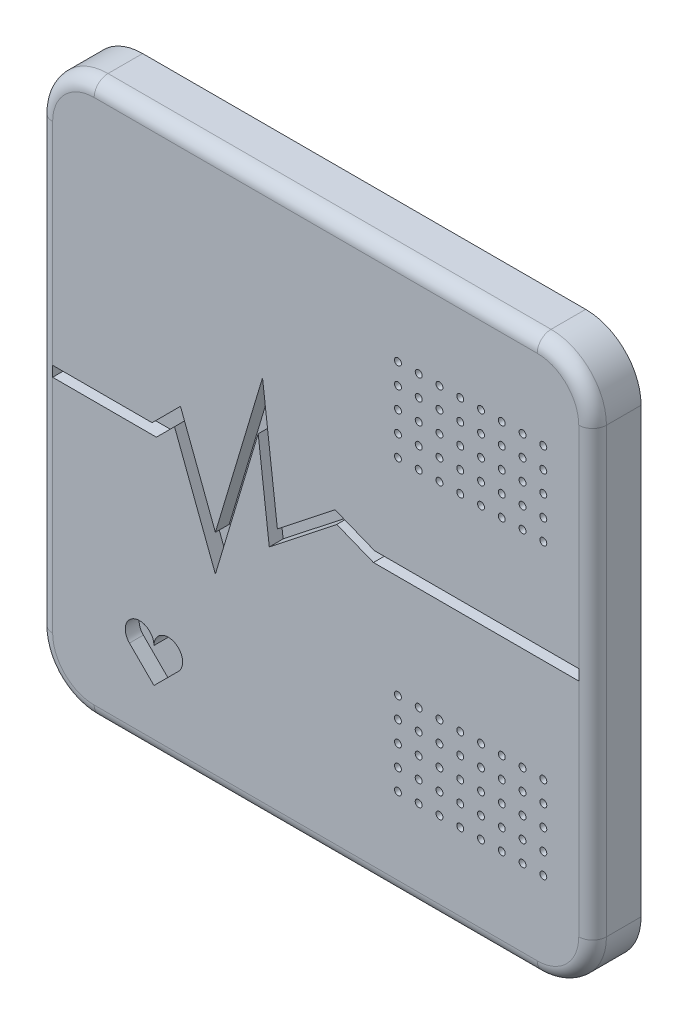
from build123d import *

# Parameters (mm, degrees)
ESQUISSE1_W             = 80
ESQUISSE1_H             = 80
BOSS_EXTRU_1_DEPTH      = 7
CONG_1_R                = 8
CONG_2_R                = 2
ESQUISSE2_W             = 75
ESQUISSE2_H             = 75
ENL_V_MAT_EXTRU_1_DEPTH = 4
ENL_V_MAT_EXTRU_2_DEPTH = 2
ENL_V_MAT_EXTRU_3_DEPTH = 2
ESQUISSE6_R             = 0.5
ENL_V_MAT_EXTRU_4_DEPTH = 58
CONG_3_R                = 3


with BuildPart() as part:
    # Esquisse1 → Boss.-Extru.1 (new body)
    with BuildSketch(Plane.XY):
        Rectangle(ESQUISSE1_W, ESQUISSE1_H)
    extrude(amount=BOSS_EXTRU_1_DEPTH)

    # Congé1
    cong_1_edges = [part.edges().sort_by_distance(p)[0] for p in [
        (40, -40, 3.5),
        (-40, -40, 3.5),
        (-40, 40, 3.5),
        (40, 40, 3.5),
    ]]
    fillet(cong_1_edges, radius=CONG_1_R)

    # Congé2
    cong_2_edges = [part.edges().sort_by_distance(p)[0] for p in [
        (0, -40, 7),
        (-40, 0, 7),
        (40, 0, 7),
        (0, 40, 7),
        (37.656854249, 37.656854249, 7),
        (37.656854249, -37.656854249, 7),
        (-37.656854249, 37.656854249, 7),
        (-37.656854249, -37.656854249, 7),
    ]]
    fillet(cong_2_edges, radius=CONG_2_R)

    # Esquisse2 → Enlèv. mat.-Extru.1 (cut)
    with BuildSketch(Plane(origin=(0, 0, 0), x_dir=(-1, 0, 0), z_dir=(0, 0, -1))):
        Rectangle(ESQUISSE2_W, ESQUISSE2_H)
    extrude(amount=-ENL_V_MAT_EXTRU_1_DEPTH, mode=Mode.SUBTRACT)

    # Esquisse3 → Enlèv. mat.-Extru.2 (cut)
    with BuildSketch(Plane.XY.offset(7)):
        Polygon((-38, 0), (-23.013072884, 0), (-20.39099813, 2.622074754), (-16.095973356, -8.657779106), (-14.491160811, -12.872434885), (-8.308759443, 7.774506113), (-6.706462268, -5.579927642), (3.046694847, 2.110487656), (8.341678265, 0), (38, 0), (38, 1.552153758), (8.49875294, 1.552153758), (2.797806202, 3.824451283), (-5.535661698, -2.746531659), (-7.678112046, 15.109838358), (-14.491160811, -7.643232416), (-19.53394935, 5.600443877), (-23.634393227, 1.5), (-38, 1.5), align=None)
    extrude(amount=-ENL_V_MAT_EXTRU_2_DEPTH, mode=Mode.SUBTRACT)

    # Esquisse4 → Enlèv. mat.-Extru.3 (cut)
    with BuildSketch(Plane.XY.offset(7)):
        with BuildLine():
            Line((-26.903531704, -27.704969904), (-23.364970672, -31.243530936))
            Line((-23.364970672, -31.243530936), (-19.826409639, -27.704969904))
            ThreePointArc((-19.826409639, -27.704969904), (-20.498887678, -24.324194502), (-23.364970672, -26.239249933))
            ThreePointArc((-23.364970672, -26.239249933), (-26.231053665, -24.324194502), (-26.903531704, -27.704969904))
        make_face()
    extrude(amount=-ENL_V_MAT_EXTRU_3_DEPTH, mode=Mode.SUBTRACT)

    # Esquisse6 → Enlèv. mat.-Extru.4 (cut, through all)
    with BuildSketch(Plane.XY.offset(7)):
        with Locations((11.879182911, 26.878201105)):
            Circle(ESQUISSE6_R)
        with Locations((14.879182911, 26.878201105)):
            Circle(ESQUISSE6_R)
        with Locations((17.879182911, 26.878201105)):
            Circle(ESQUISSE6_R)
        with Locations((20.879182911, 26.878201105)):
            Circle(ESQUISSE6_R)
        with Locations((23.879182911, 26.878201105)):
            Circle(ESQUISSE6_R)
        with Locations((26.879182911, 26.878201105)):
            Circle(ESQUISSE6_R)
        with Locations((29.879182911, 26.878201105)):
            Circle(ESQUISSE6_R)
        with Locations((32.879182911, 26.878201105)):
            Circle(ESQUISSE6_R)
        with Locations((14.879182911, 23.878201105)):
            Circle(ESQUISSE6_R)
        with Locations((17.879182911, 23.878201105)):
            Circle(ESQUISSE6_R)
        with Locations((20.879182911, 23.878201105)):
            Circle(ESQUISSE6_R)
        with Locations((23.879182911, 23.878201105)):
            Circle(ESQUISSE6_R)
        with Locations((26.879182911, 23.878201105)):
            Circle(ESQUISSE6_R)
        with Locations((29.879182911, 23.878201105)):
            Circle(ESQUISSE6_R)
        with Locations((32.879182911, 23.878201105)):
            Circle(ESQUISSE6_R)
        with Locations((14.879182911, 20.878201105)):
            Circle(ESQUISSE6_R)
        with Locations((17.879182911, 20.878201105)):
            Circle(ESQUISSE6_R)
        with Locations((20.879182911, 20.878201105)):
            Circle(ESQUISSE6_R)
        with Locations((23.879182911, 20.878201105)):
            Circle(ESQUISSE6_R)
        with Locations((26.879182911, 20.878201105)):
            Circle(ESQUISSE6_R)
        with Locations((29.879182911, 20.878201105)):
            Circle(ESQUISSE6_R)
        with Locations((32.879182911, 20.878201105)):
            Circle(ESQUISSE6_R)
        with Locations((14.879182911, 17.878201105)):
            Circle(ESQUISSE6_R)
        with Locations((17.879182911, 17.878201105)):
            Circle(ESQUISSE6_R)
        with Locations((20.879182911, 17.878201105)):
            Circle(ESQUISSE6_R)
        with Locations((23.879182911, 17.878201105)):
            Circle(ESQUISSE6_R)
        with Locations((26.879182911, 17.878201105)):
            Circle(ESQUISSE6_R)
        with Locations((29.879182911, 17.878201105)):
            Circle(ESQUISSE6_R)
        with Locations((32.879182911, 17.878201105)):
            Circle(ESQUISSE6_R)
        with Locations((14.879182911, 14.878201105)):
            Circle(ESQUISSE6_R)
        with Locations((17.879182911, 14.878201105)):
            Circle(ESQUISSE6_R)
        with Locations((20.879182911, 14.878201105)):
            Circle(ESQUISSE6_R)
        with Locations((23.879182911, 14.878201105)):
            Circle(ESQUISSE6_R)
        with Locations((26.879182911, 14.878201105)):
            Circle(ESQUISSE6_R)
        with Locations((29.879182911, 14.878201105)):
            Circle(ESQUISSE6_R)
        with Locations((32.879182911, 14.878201105)):
            Circle(ESQUISSE6_R)
        with Locations((11.879182911, 23.878201105)):
            Circle(ESQUISSE6_R)
        with Locations((11.879182911, 20.878201105)):
            Circle(ESQUISSE6_R)
        with Locations((11.879182911, 17.878201105)):
            Circle(ESQUISSE6_R)
        with Locations((11.879182911, 14.878201105)):
            Circle(ESQUISSE6_R)
    enl_v_mat_extru_4 = extrude(amount=-ENL_V_MAT_EXTRU_4_DEPTH, mode=Mode.SUBTRACT)

    # Symétrie2: Enlèv. mat.-Extru.4 across plane
    add(enl_v_mat_extru_4.mirror(Plane.ZX), mode=Mode.SUBTRACT)

    # Congé3
    cong_3_edges = [part.edges().sort_by_distance(p)[0] for p in [
        (-37.5, 37.5, 2),
        (-37.5, -37.5, 2),
        (37.5, -37.5, 2),
        (37.5, 37.5, 2),
    ]]
    fillet(cong_3_edges, radius=CONG_3_R)


solid = part.part
